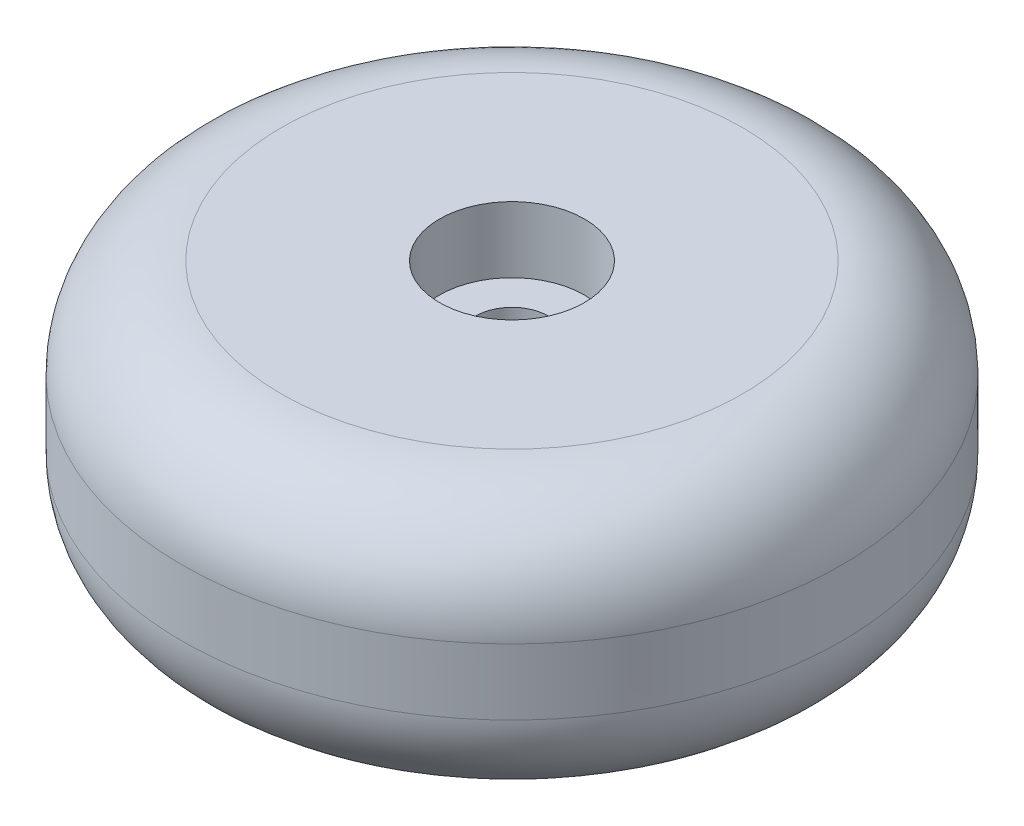
from build123d import *

# Parameters (mm, degrees)
FILLET1_R = 6


with BuildPart() as part:
    # Sketch1 → Revolve1 (revolve)
    with BuildSketch(Plane.XY, mode=Mode.PRIVATE) as revolve1_sk:
        Polygon((4.4, 16), (4.4, 12), (2.2, 12), (2.2, 0), (20, 0), (20, 16), align=None)
    revolve(revolve1_sk.sketch.rotate(Axis((0, 0, 0), (0, 1, 0)), 90), axis=Axis((0, 0, 0), (0, 1, 0)))

    # Fillet1
    fillet1_edges = [part.edges().sort_by_distance(p)[0] for p in [
        (0, 16, 20),
        (0, 0, 20),
    ]]
    fillet(fillet1_edges, radius=FILLET1_R)


solid = part.part
